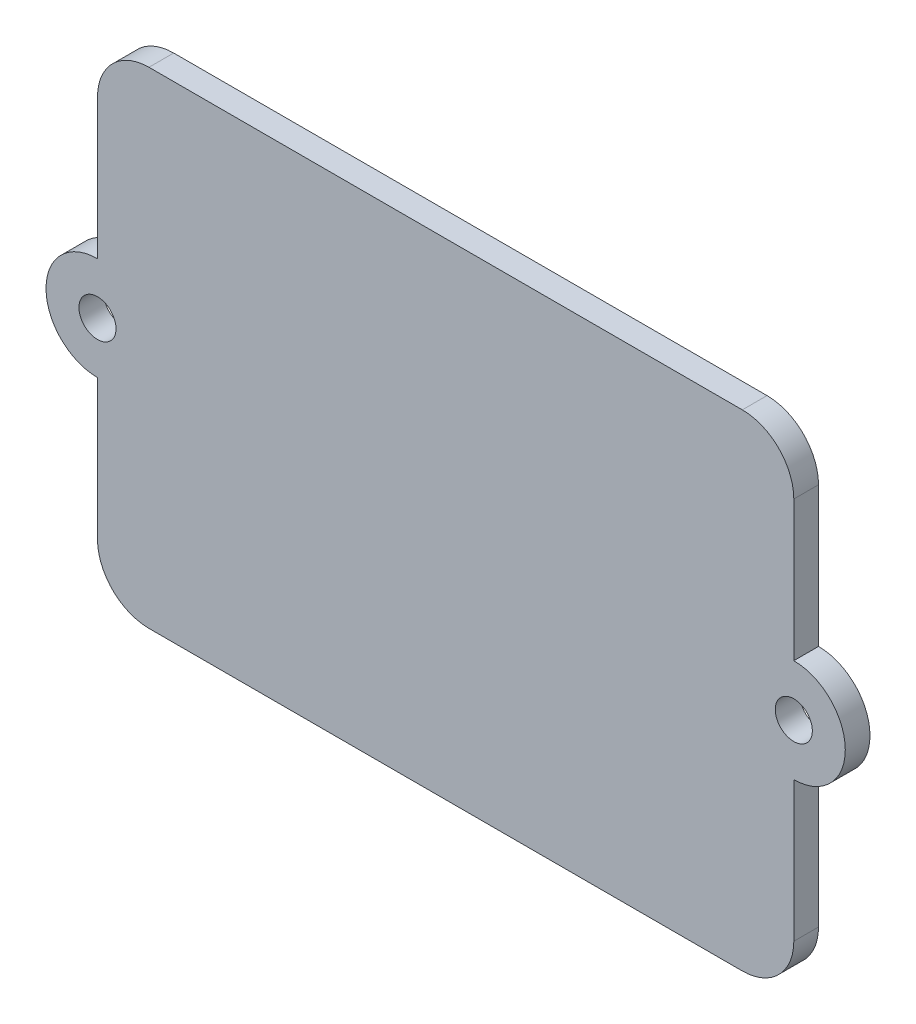
from build123d import *

# Parameters (mm, degrees)
SKETCH1_W           = 42.9449992
SKETCH1_H           = 29.972
BOSS_EXTRUDE1_DEPTH = 1.524
SKETCH2_R           = 3.175
BOSS_EXTRUDE2_DEPTH = 1.524
SKETCH3_R           = 1.143
CUT_EXTRUDE1_DEPTH  = 56.024518955
FILLET1_R           = 3.175


with BuildPart() as part:
    # Sketch1 → Boss-Extrude1 (new body)
    with BuildSketch(Plane.XY):
        with Locations((21.4724996, 14.986)):
            Rectangle(SKETCH1_W, SKETCH1_H)
    extrude(amount=BOSS_EXTRUDE1_DEPTH)

    # Sketch2 → Boss-Extrude2 (add)
    with BuildSketch(Plane.XY.offset(1.524)):
        with Locations((0, 14.986)):
            Circle(SKETCH2_R)
        with Locations((42.9449992, 14.986)):
            Circle(SKETCH2_R)
    extrude(amount=-BOSS_EXTRUDE2_DEPTH)

    # Sketch3 → Cut-Extrude1 (cut, through all)
    with BuildSketch(Plane.XY.offset(1.524)):
        with Locations((0, 14.986)):
            Circle(SKETCH3_R)
        with Locations((42.9449992, 14.986)):
            Circle(SKETCH3_R)
    extrude(amount=-CUT_EXTRUDE1_DEPTH, mode=Mode.SUBTRACT)

    # Fillet1
    fillet1_edges = [part.edges().sort_by_distance(p)[0] for p in [
        (0, 29.972, 0.762),
        (42.9449992, 29.972, 0.762),
        (42.9449992, 0, 0.762),
        (0, 0, 0.762),
    ]]
    fillet(fillet1_edges, radius=FILLET1_R)


solid = part.part
